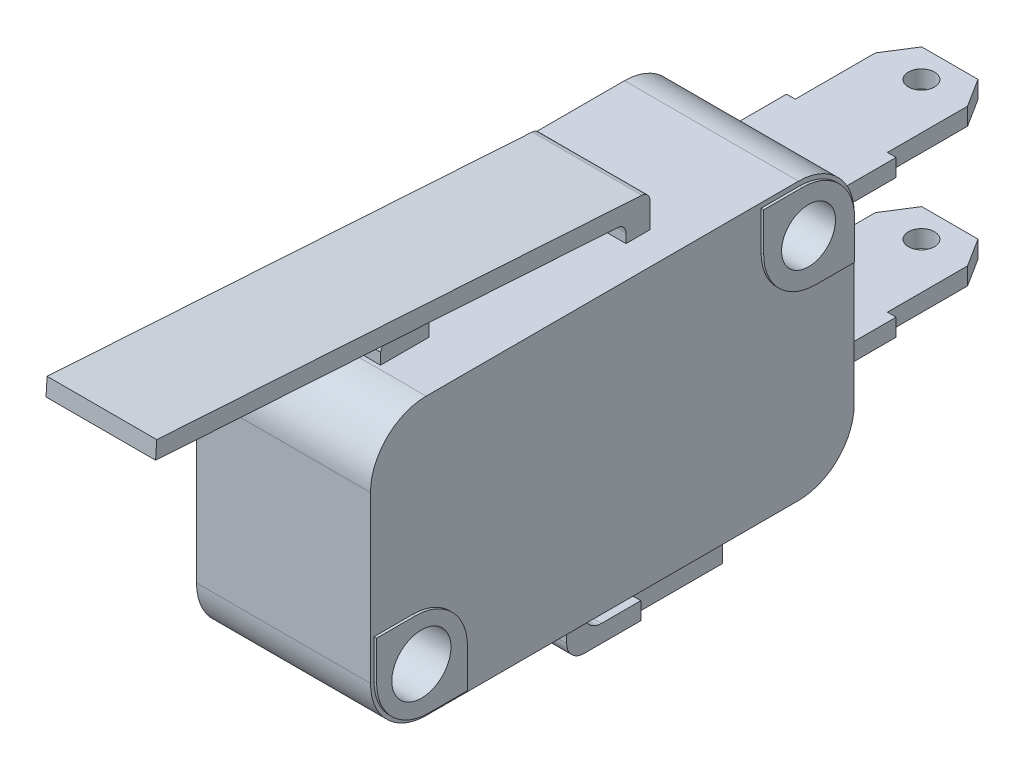
from build123d import *
from OCP.BRepFilletAPI import BRepFilletAPI_MakeChamfer

# Parameters (mm, degrees)
BOSS_EXTRUDE1_DEPTH        = 6.3
SKETCH2_W                  = 6.3
SKETCH2_H                  = 1.380694599
BOSS_EXTRUDE2_DEPTH        = 16.905731032
SKETCH3_W                  = 1.380694599
SKETCH3_H                  = 17.819618065
BOSS_EXTRUDE3_DEPTH        = 1.85
SKETCH4_W                  = 6.3
SKETCH4_H                  = 1
BOSS_EXTRUDE4_DEPTH        = 27.089061168
SKETCH5_W                  = 8.15
SKETCH5_H                  = 17.819618065
BOSS_EXTRUDE5_DEPTH        = 9.886282081
CUT_EXTRUDE1_DEPTH         = 0.913887033
CUT_EXTRUDE2_DEPTH         = 1.005731032
SKETCH8_W                  = 8.15
SKETCH8_H                  = 15.9
BOSS_EXTRUDE6_DEPTH        = 16.53302332
SKETCH9_W                  = 27.8
SKETCH9_H                  = 15.9
BOSS_EXTRUDE7_DEPTH        = 1.85
SKETCH10_W                 = 6.3
SKETCH10_H                 = 1
BOSS_EXTRUDE8_DEPTH        = 3.3
SKETCH11_W                 = 6.3
SKETCH11_H                 = 1
BOSS_EXTRUDE9_DEPTH        = 9.5
SKETCH12_W                 = 0.5
SKETCH12_H                 = 6.238763167
CUT_EXTRUDE3_DEPTH         = 34.186119519
SKETCH13_W                 = 0.5
SKETCH13_H                 = 6.238763167
CUT_EXTRUDE4_DEPTH         = 34.186119519
SKETCH14_W                 = 6.3
SKETCH14_H                 = 1
BOSS_EXTRUDE10_DEPTH       = 10.5
SKETCH15_W                 = 0.5
SKETCH15_H                 = 6.238763167
CUT_EXTRUDE5_DEPTH         = 29.93500176
SKETCH16_W                 = 0.5
SKETCH16_H                 = 6.238763167
CUT_EXTRUDE6_DEPTH         = 29.93500176
SKETCH17_W                 = 6.3
SKETCH17_H                 = 1
BOSS_EXTRUDE11_DEPTH       = 10.5
SKETCH18_W                 = 0.5
SKETCH18_H                 = 6.238763167
CUT_EXTRUDE7_DEPTH         = 30.688072067
SKETCH19_W                 = 0.5
SKETCH19_H                 = 6.238763167
CUT_EXTRUDE8_DEPTH         = 30.688072067
SKETCH20_W                 = 5.225
SKETCH20_H                 = 5.225
BOSS_EXTRUDE12_DEPTH       = 0.15
SKETCH21_W                 = 5.225
SKETCH21_H                 = 5.225
BOSS_EXTRUDE13_DEPTH       = 0.15
BOSS_EXTRUDE14_DEPTH       = 4.3
SKETCH23_W                 = 5.225
SKETCH23_H                 = 5.225
BOSS_EXTRUDE15_DEPTH       = 0.15
SKETCH24_W                 = 5.225
SKETCH24_H                 = 5.225
BOSS_EXTRUDE16_DEPTH       = 0.15
F_4_CLEARANCE_HOLE1_D      = 3.4
F_00_CLEARANCE_HOLE1_D     = 1.5
F_00_CLEARANCE_HOLE1_DEPTH = 1
F_00_CLEARANCE_HOLE2_D     = 1.5
F_00_CLEARANCE_HOLE2_DEPTH = 15.725
F_4_CLEARANCE_HOLE2_D      = 3.1
F_00_CLEARANCE_HOLE3_D     = 1.5
F_00_CLEARANCE_HOLE3_DEPTH = 1
CHAMFER1_SIZE              = 1.632857048
CHAMFER1_SIZE2             = 1.033032958
CHAMFER2_SIZE              = 1.033032958
CHAMFER2_SIZE2             = 1.632857048
CHAMFER3_SIZE              = 1.632857048
CHAMFER3_SIZE2             = 1.033032958
FILLET1_R                  = 0.5
FILLET2_R                  = 1
FILLET3_R                  = 3
FILLET4_R                  = 3.2


with BuildPart() as part:
    # Sketch1 → Boss-Extrude1 (new body)
    with BuildSketch(Plane(origin=(3.15, 0, 0), x_dir=(0, 0, -1), z_dir=(1, 0, 0))):
        Polygon((2.63302332, 8.955731032), (4.013717919, 8.955731032), (4.013717919, 9.869618065), (2.696737492, 9.95369922), align=None)
    extrude(amount=-BOSS_EXTRUDE1_DEPTH)

    # Sketch2 → Boss-Extrude2 (add)
    with BuildSketch(Plane.XZ.offset(-8.955731032)):
        with Locations((0, -3.32337062)):
            Rectangle(SKETCH2_W, SKETCH2_H)
    extrude(amount=BOSS_EXTRUDE2_DEPTH)

    # Sketch3 → Boss-Extrude3 (add)
    with BuildSketch(Plane(origin=(3.15, 0, 0), x_dir=(0, 0, -1), z_dir=(1, 0, 0))):
        with Locations((3.32337062, 0.959809033)):
            Rectangle(SKETCH3_W, SKETCH3_H)
    extrude(amount=BOSS_EXTRUDE3_DEPTH)

    # Sketch4 → Boss-Extrude4 (add)
    with BuildSketch(Plane(origin=(0, -0.131064291, -2.052886948), x_dir=(1, 0, 0), z_dir=(0, 0.06371417237061536, 0.9979681879895409))):
        with Locations((0, 9.605295572)):
            Rectangle(SKETCH4_W, SKETCH4_H)
    extrude(amount=BOSS_EXTRUDE4_DEPTH)

    # Sketch5 → Boss-Extrude5 (add)
    with BuildSketch(Plane(origin=(0, 0, -4.013717919), x_dir=(-1, 0, 0), z_dir=(0, 0, -1))):
        with Locations((-0.925, 0.959809033)):
            Rectangle(SKETCH5_W, SKETCH5_H)
    extrude(amount=BOSS_EXTRUDE5_DEPTH)

    # Sketch6 → Cut-Extrude1 (cut)
    with BuildSketch(Plane(origin=(0, 9.869618065, 0), x_dir=(-1, 0, 0), z_dir=(0, 1, 0))):
        Polygon((-3.15, -4.013717919), (-3.15, -2.63302332), (-5, -2.63302332), (-5, -13.9), (3.15, -13.9), (3.15, -4.013717919), align=None)
    extrude(amount=-CUT_EXTRUDE1_DEPTH, mode=Mode.SUBTRACT)

    # Sketch7 → Cut-Extrude2 (cut)
    with BuildSketch(Plane(origin=(0, 8.955731032, 0), x_dir=(-1, 0, 0), z_dir=(0, 1, 0))):
        Polygon((-3.15, -4.013717919), (-3.15, -2.63302332), (-5, -2.63302332), (-5, -13.9), (3.15, -13.9), (3.15, -4.013717919), align=None)
    extrude(amount=-CUT_EXTRUDE2_DEPTH, mode=Mode.SUBTRACT)

    # Sketch8 → Boss-Extrude6 (add)
    with BuildSketch(Plane.XY.offset(-2.63302332)):
        with Locations((0.925, 0)):
            Rectangle(SKETCH8_W, SKETCH8_H)
    extrude(amount=BOSS_EXTRUDE6_DEPTH)

    # Sketch9 → Boss-Extrude7 (add)
    with BuildSketch(Plane.ZY.offset(3.15)):
        Rectangle(SKETCH9_W, SKETCH9_H)
    extrude(amount=BOSS_EXTRUDE7_DEPTH)

    # Sketch10 → Boss-Extrude8 (add)
    with BuildSketch(Plane.XZ.offset(7.95)):
        with Locations((0, 0.275)):
            Rectangle(SKETCH10_W, SKETCH10_H)
    extrude(amount=BOSS_EXTRUDE8_DEPTH)

    # Sketch11 → Boss-Extrude9 (add)
    with BuildSketch(Plane(origin=(0, 0, -0.225), x_dir=(-1, 0, 0), z_dir=(0, 0, -1))):
        with Locations((0, -10.75)):
            Rectangle(SKETCH11_W, SKETCH11_H)
    extrude(amount=BOSS_EXTRUDE9_DEPTH)

    # Sketch12 → Cut-Extrude3 (cut, through all)
    with BuildSketch(Plane(origin=(0, -10.25, 0), x_dir=(-1, 0, 0), z_dir=(0, 1, 0))):
        with Locations((2.9, -6.605618417)):
            Rectangle(SKETCH12_W, SKETCH12_H)
    extrude(amount=-CUT_EXTRUDE3_DEPTH, mode=Mode.SUBTRACT)

    # Sketch13 → Cut-Extrude4 (cut, through all)
    with BuildSketch(Plane(origin=(0, -10.25, 0), x_dir=(-1, 0, 0), z_dir=(0, 1, 0))):
        with Locations((-2.9, -6.605618417)):
            Rectangle(SKETCH13_W, SKETCH13_H)
    extrude(amount=-CUT_EXTRUDE4_DEPTH, mode=Mode.SUBTRACT)

    # Sketch14 → Boss-Extrude10 (add)
    with BuildSketch(Plane(origin=(0, 0, -13.9), x_dir=(-1, 0, 0), z_dir=(0, 0, -1))):
        with Locations((0, 3.975)):
            Rectangle(SKETCH14_W, SKETCH14_H)
    extrude(amount=BOSS_EXTRUDE10_DEPTH)

    # Sketch15 → Cut-Extrude5 (cut, through all)
    with BuildSketch(Plane.XZ.offset(-3.475)):
        with Locations((2.9, -21.280618417)):
            Rectangle(SKETCH15_W, SKETCH15_H)
    extrude(amount=-CUT_EXTRUDE5_DEPTH, mode=Mode.SUBTRACT)

    # Sketch16 → Cut-Extrude6 (cut, through all)
    with BuildSketch(Plane.XZ.offset(-3.475)):
        with Locations((-2.9, -21.280618417)):
            Rectangle(SKETCH16_W, SKETCH16_H)
    extrude(amount=-CUT_EXTRUDE6_DEPTH, mode=Mode.SUBTRACT)

    # Sketch17 → Boss-Extrude11 (add)
    with BuildSketch(Plane(origin=(0, 0, -13.9), x_dir=(-1, 0, 0), z_dir=(0, 0, -1))):
        with Locations((0, -3.975)):
            Rectangle(SKETCH17_W, SKETCH17_H)
    extrude(amount=BOSS_EXTRUDE11_DEPTH)

    # Sketch18 → Cut-Extrude7 (cut, through all)
    with BuildSketch(Plane.XZ.offset(4.475)):
        with Locations((2.9, -21.280618417)):
            Rectangle(SKETCH18_W, SKETCH18_H)
    extrude(amount=-CUT_EXTRUDE7_DEPTH, mode=Mode.SUBTRACT)

    # Sketch19 → Cut-Extrude8 (cut, through all)
    with BuildSketch(Plane.XZ.offset(4.475)):
        with Locations((-2.9, -21.280618417)):
            Rectangle(SKETCH19_W, SKETCH19_H)
    extrude(amount=-CUT_EXTRUDE8_DEPTH, mode=Mode.SUBTRACT)

    # Sketch20 → Boss-Extrude12 (add)
    with BuildSketch(Plane(origin=(5, 0, 0), x_dir=(0, 0, -1), z_dir=(1, 0, 0))):
        with Locations((11.1625, 5.0625)):
            Rectangle(SKETCH20_W, SKETCH20_H)
    extrude(amount=BOSS_EXTRUDE12_DEPTH)

    # Sketch21 → Boss-Extrude13 (add)
    with BuildSketch(Plane(origin=(5, 0, 0), x_dir=(0, 0, -1), z_dir=(1, 0, 0))):
        with Locations((-11.0875, -5.1375)):
            Rectangle(SKETCH21_W, SKETCH21_H)
    extrude(amount=BOSS_EXTRUDE13_DEPTH)

    # Sketch22 → Boss-Extrude14 (add)
    with BuildSketch(Plane(origin=(-2.15, 0, 0), x_dir=(0, -1, 0), z_dir=(-1, 0, 0))):
        with BuildLine():
            Line((-8.6, 7.675), (-7.95, 7.675))
            Line((-7.95, 7.675), (-7.95, 10.475))
            Line((-7.95, 10.475), (-8.6, 10.475))
            ThreePointArc((-8.6, 10.475), (-9.6, 9.075), (-8.6, 7.675))
        make_face()
    extrude(amount=-BOSS_EXTRUDE14_DEPTH)

    # Sketch23 → Boss-Extrude15 (add)
    with BuildSketch(Plane.ZY.offset(5)):
        with Locations((-11.1625, 5.0625)):
            Rectangle(SKETCH23_W, SKETCH23_H)
    extrude(amount=BOSS_EXTRUDE15_DEPTH)

    # Sketch24 → Boss-Extrude16 (add)
    with BuildSketch(Plane.ZY.offset(5)):
        with Locations((11.0875, -5.1375)):
            Rectangle(SKETCH24_W, SKETCH24_H)
    extrude(amount=BOSS_EXTRUDE16_DEPTH)

    # #4 Clearance Hole1 (through all)
    with Locations(Plane(origin=(5.15, 0, 0), x_dir=(0, 0, -1), z_dir=(1, 0, 0))):
        with Locations((-11.125, -5.1)):
            Hole(F_4_CLEARANCE_HOLE1_D / 2)

    # #00 Clearance Hole1
    with Locations(Plane(origin=(0, -4.475, 0), x_dir=(-1, 0, 0), z_dir=(0, -1, 0))):
        with Locations((0, 22.767142952)):
            Hole(F_00_CLEARANCE_HOLE1_D / 2, depth=F_00_CLEARANCE_HOLE1_DEPTH)

    # #00 Clearance Hole2
    with Locations(Plane(origin=(0, 4.475, 0), x_dir=(1, 0, 0), z_dir=(0, 1, 0))):
        with Locations((0, 22.767142952)):
            Hole(F_00_CLEARANCE_HOLE2_D / 2, depth=F_00_CLEARANCE_HOLE2_DEPTH)

    # #4 Clearance Hole2 (through all)
    with Locations(Plane(origin=(5.15, 0, 0), x_dir=(0, 0, -1), z_dir=(1, 0, 0))):
        with Locations((11.125, 5.1)):
            Hole(F_4_CLEARANCE_HOLE2_D / 2)

    # #00 Clearance Hole3
    with Locations(Plane(origin=(0, -10.25, 0), x_dir=(1, 0, 0), z_dir=(0, 1, 0))):
        with Locations((0, 8.092142952)):
            Hole(F_00_CLEARANCE_HOLE3_D / 2, depth=F_00_CLEARANCE_HOLE3_DEPTH)

    # Chamfer1: one chamfer whose edges measure the first distance from different faces: ONE call of the kernel's chamfer builder (chamfer() names one face for all edges)
    chamfer1_edges_1 = [part.edges().sort_by_distance(p)[0] for p in [
        (-2.65, 3.975, -24.4),
    ]]
    chamfer1_side_1 = [part.faces().sort_by_distance(p)[0] for p in [
        (-2.65, 3.975, -21.280618417),
    ]]
    chamfer1_edges_2 = [part.edges().sort_by_distance(p)[0] for p in [
        (-2.65, -3.975, -24.4),
    ]]
    chamfer1_side_2 = [part.faces().sort_by_distance(p)[0] for p in [
        (-2.65, -3.975, -21.280618417),
    ]]
    chamfer1 = BRepFilletAPI_MakeChamfer(part.part.solid().wrapped)
    for e in chamfer1_edges_1:
        chamfer1.Add(CHAMFER1_SIZE, CHAMFER1_SIZE2, e.wrapped, chamfer1_side_1[0].wrapped)  # the first distance lies on this face
    for e in chamfer1_edges_2:
        chamfer1.Add(CHAMFER1_SIZE, CHAMFER1_SIZE2, e.wrapped, chamfer1_side_2[0].wrapped)  # the first distance lies on this face
    add(Compound.cast(chamfer1.Shape()), mode=Mode.REPLACE)

    # Chamfer2: one chamfer whose edges measure the first distance from different faces: ONE call of the kernel's chamfer builder (chamfer() names one face for all edges)
    chamfer2_edges_1 = [part.edges().sort_by_distance(p)[0] for p in [
        (2.65, 3.975, -24.4),
    ]]
    chamfer2_side_1 = [part.faces().sort_by_distance(p)[0] for p in [
        (0.516516479, 3.975, -24.4),
    ]]
    chamfer2_edges_2 = [part.edges().sort_by_distance(p)[0] for p in [
        (2.65, -3.975, -24.4),
    ]]
    chamfer2_side_2 = [part.faces().sort_by_distance(p)[0] for p in [
        (0.516516479, -3.975, -24.4),
    ]]
    chamfer2 = BRepFilletAPI_MakeChamfer(part.part.solid().wrapped)
    for e in chamfer2_edges_1:
        chamfer2.Add(CHAMFER2_SIZE, CHAMFER2_SIZE2, e.wrapped, chamfer2_side_1[0].wrapped)  # the first distance lies on this face
    for e in chamfer2_edges_2:
        chamfer2.Add(CHAMFER2_SIZE, CHAMFER2_SIZE2, e.wrapped, chamfer2_side_2[0].wrapped)  # the first distance lies on this face
    add(Compound.cast(chamfer2.Shape()), mode=Mode.REPLACE)

    # Chamfer3: one chamfer whose edges measure the first distance from different faces: ONE call of the kernel's chamfer builder (chamfer() names one face for all edges)
    chamfer3_edges_1 = [part.edges().sort_by_distance(p)[0] for p in [
        (-2.65, -10.75, -9.725),
    ]]
    chamfer3_side_1 = [part.faces().sort_by_distance(p)[0] for p in [
        (-2.65, -10.75, -6.605618417),
    ]]
    chamfer3_edges_2 = [part.edges().sort_by_distance(p)[0] for p in [
        (2.65, -10.75, -9.725),
    ]]
    chamfer3_side_2 = [part.faces().sort_by_distance(p)[0] for p in [
        (0, -10.75, -9.725),
    ]]
    chamfer3 = BRepFilletAPI_MakeChamfer(part.part.solid().wrapped)
    for e in chamfer3_edges_1:
        chamfer3.Add(CHAMFER3_SIZE, CHAMFER3_SIZE2, e.wrapped, chamfer3_side_1[0].wrapped)  # the first distance lies on this face
    for e in chamfer3_edges_2:
        chamfer3.Add(CHAMFER3_SIZE, CHAMFER3_SIZE2, e.wrapped, chamfer3_side_2[0].wrapped)  # the first distance lies on this face
    add(Compound.cast(chamfer3.Shape()), mode=Mode.REPLACE)

    # Fillet1
    fillet1_edges = [part.edges().sort_by_distance(p)[0] for p in [
        (0, 9.869618065, -4.013717919),
        (0, 8.955731032, -2.63302332),
    ]]
    fillet(fillet1_edges, radius=FILLET1_R)

    # Fillet2
    fillet2_edges = [part.edges().sort_by_distance(p)[0] for p in [
        (0, -11.25, 0.775),
        (0, -10.25, -0.225),
    ]]
    fillet(fillet2_edges, radius=FILLET2_R)

    # Fillet3
    fillet3_edges = [part.edges().sort_by_distance(p)[0] for p in [
        (5.075, 2.45, -8.55),
        (5.075, 7.675, -13.775),
        (5.075, -7.75, 13.7),
        (5.075, -2.525, 8.475),
        (-5.075, 2.45, -8.55),
        (-5.075, 7.675, -13.775),
        (-5.075, -7.75, 13.7),
        (-5.075, -2.525, 8.475),
    ]]
    fillet(fillet3_edges, radius=FILLET3_R)

    # Fillet4
    fillet4_edges = [part.edges().sort_by_distance(p)[0] for p in [
        (0, -7.95, 13.9),
        (0, 7.95, 13.9),
        (0, -7.95, -13.9),
        (0, 7.95, -13.9),
    ]]
    fillet(fillet4_edges, radius=FILLET4_R)


solid = part.part
